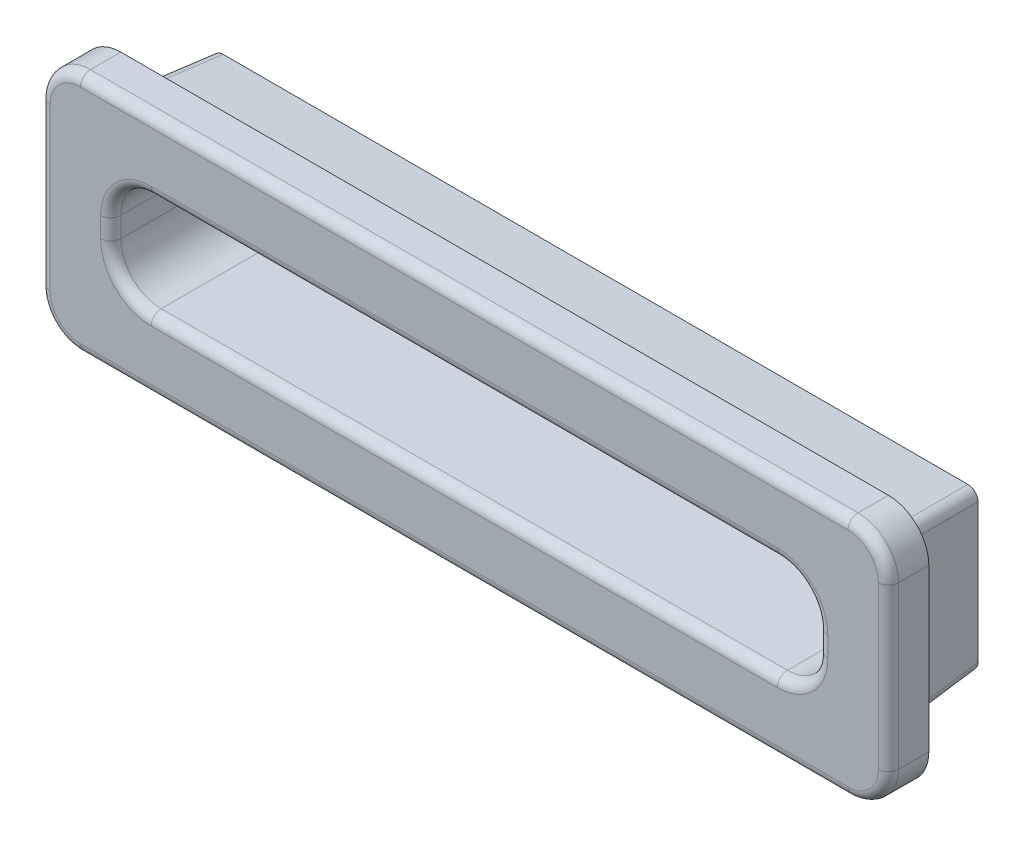
from build123d import *

# Parameters (mm, degrees)
SKETCH2_W           = 84
SKETCH2_H           = 24
SKETCH2_W_2         = 70
SKETCH2_H_2         = 10
BOSS_EXTRUDE1_DEPTH = 4
SKETCH3_W           = 77
SKETCH3_H           = 17
SKETCH3_W_2         = 70
SKETCH3_H_2         = 10
BOSS_EXTRUDE2_DEPTH = 9
DRAFT2_ANGLE        = 4
FILLET2_R           = 4
FILLET1_R           = 1
FILLET3_R           = 1


with BuildPart() as part:
    # Sketch2 → Boss-Extrude1 (new body)
    with BuildSketch(Plane.XY):
        Rectangle(SKETCH2_W, SKETCH2_H)
        Rectangle(SKETCH2_W_2, SKETCH2_H_2, mode=Mode.SUBTRACT)
    extrude(amount=BOSS_EXTRUDE1_DEPTH)

    # Sketch3 → Boss-Extrude2 (add)
    with BuildSketch(Plane.XY):
        Rectangle(SKETCH3_W, SKETCH3_H)
        Rectangle(SKETCH3_W_2, SKETCH3_H_2, mode=Mode.SUBTRACT)
    extrude(amount=-BOSS_EXTRUDE2_DEPTH)

    # Draft2
    draft2_faces = [part.faces().sort_by_distance(p)[0] for p in [
        (0, 8.5, -4.5),
        (-38.5, 0, -4.5),
        (38.5, 0, -4.5),
        (0, -8.5, -4.5),
    ]]
    draft(draft2_faces, Plane(origin=(0, 0, 0), x_dir=(-1, 0, 0), z_dir=(0, 0, -1)), DRAFT2_ANGLE)

    # Fillet2
    fillet2_edges = [part.edges().sort_by_distance(p)[0] for p in [
        (35, -5, -2.5),
        (35, 5, -2.5),
        (-35, 5, -2.5),
        (-35, -5, -2.5),
        (42, -12, 2),
        (-42, -12, 2),
        (-42, 12, 2),
        (42, 12, 2),
    ]]
    fillet(fillet2_edges, radius=FILLET2_R)

    # Fillet1
    fillet1_edges = [part.edges().sort_by_distance(p)[0] for p in [
        (0, -12, 4),
        (-42, 0, 4),
        (42, 0, 4),
        (0, 12, 4),
        (0, 5, 4),
        (35, 0, 4),
        (0, -5, 4),
        (-35, 0, 4),
        (40.828427125, -10.828427125, 4),
        (40.828427125, 10.828427125, 4),
        (-40.828427125, 10.828427125, 4),
        (-40.828427125, -10.828427125, 4),
        (33.828427125, 3.828427125, 4),
        (-33.828427125, 3.828427125, 4),
        (-33.828427125, -3.828427125, 4),
        (33.828427125, -3.828427125, 4),
    ]]
    fillet(fillet1_edges, radius=FILLET1_R)

    # Fillet3
    fillet3_edges = [part.edges().sort_by_distance(p)[0] for p in [
        (-38.185329346, -8.185329346, -4.5),
        (-38.185329346, 8.185329346, -4.5),
        (38.185329346, 8.185329346, -4.5),
        (38.185329346, -8.185329346, -4.5),
    ]]
    fillet(fillet3_edges, radius=FILLET3_R)


solid = part.part
